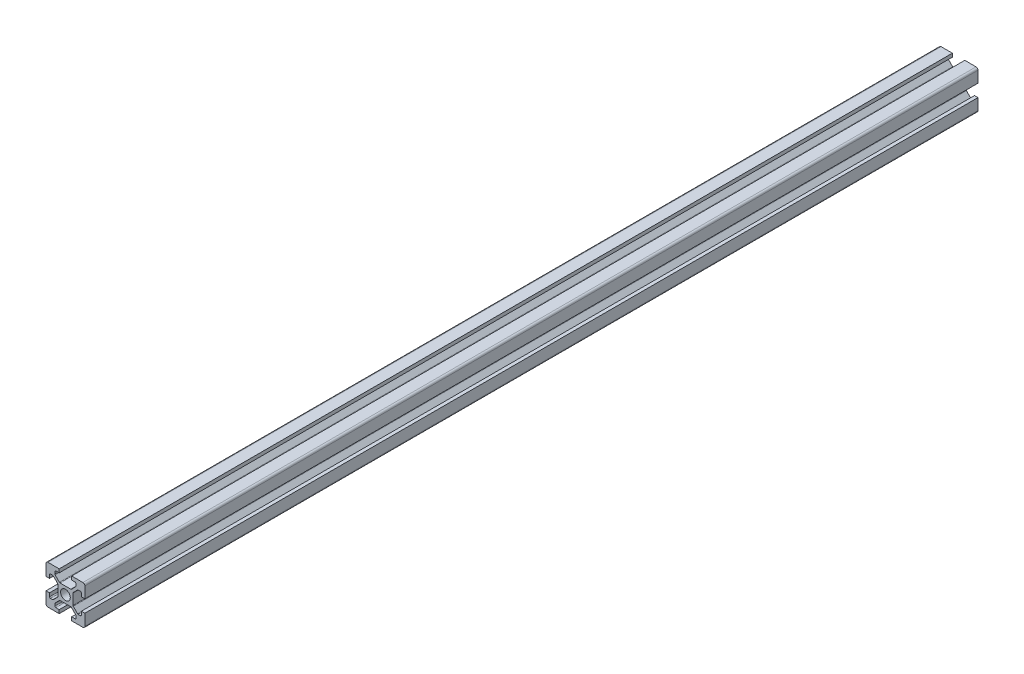
from build123d import *

# Parameters (mm, degrees)
SKETCH1_R           = 2.5
BOSS_EXTRUDE1_DEPTH = 230
FILLET1_R           = 1
FILLET2_R           = 0.5
FILLET3_R           = 0.5
FILLET4_R           = 0.5
FILLET5_R           = 0.5


with BuildPart() as part:
    # Sketch1 → Boss-Extrude1 (new, symmetric)
    with BuildSketch(Plane.XY):
        Polygon((13.2, 0), (13.2, 1.8), (15.45, 1.8), (15.45, 3.6), (12.95, 6.1), (7.05, 6.1), (4.55, 3.6), (4.55, 1.8), (6.8, 1.8), (6.8, 0), (0, 0), (0, 6.8), (1.8, 6.8), (1.8, 4.55), (3.6, 4.55), (6.1, 7.05), (6.1, 12.95), (3.6, 15.45), (1.8, 15.45), (1.8, 13.2), (0, 13.2), (0, 20), (6.8, 20), (6.8, 18.2), (4.55, 18.2), (4.55, 16.4), (7.05, 13.9), (12.95, 13.9), (15.45, 16.4), (15.45, 18.2), (13.2, 18.2), (13.2, 20), (20, 20), (20, 13.2), (18.2, 13.2), (18.2, 15.45), (16.4, 15.45), (13.9, 12.95), (13.9, 7.05), (16.4, 4.55), (18.2, 4.55), (18.2, 6.8), (20, 6.8), (20, 0), align=None)
        with Locations((10, 10)):
            Circle(SKETCH1_R, mode=Mode.SUBTRACT)
    extrude(amount=BOSS_EXTRUDE1_DEPTH, both=True)

    # Fillet1
    fillet1_edges = [part.edges().sort_by_distance(p)[0] for p in [
        (0, 0, 0),
        (0, 20, 0),
        (20, 20, 0),
        (20, 0, 0),
    ]]
    fillet(fillet1_edges, radius=FILLET1_R)

    # Fillet2
    fillet2_edges = [part.edges().sort_by_distance(p)[0] for p in [
        (4.55, 18.2, 0),
        (4.55, 16.4, 0),
        (7.05, 13.9, 0),
        (12.95, 13.9, 0),
        (15.45, 16.4, 0),
        (15.45, 18.2, 0),
    ]]
    fillet(fillet2_edges, radius=FILLET2_R)

    # Fillet3
    fillet3_edges = [part.edges().sort_by_distance(p)[0] for p in [
        (18.2, 15.45, 0),
        (16.4, 15.45, 0),
        (13.9, 12.95, 0),
        (13.9, 7.05, 0),
        (16.4, 4.55, 0),
        (18.2, 4.55, 0),
    ]]
    fillet(fillet3_edges, radius=FILLET3_R)

    # Fillet4
    fillet4_edges = [part.edges().sort_by_distance(p)[0] for p in [
        (1.8, 4.55, 0),
        (3.6, 4.55, 0),
        (6.1, 7.05, 0),
        (6.1, 12.95, 0),
        (3.6, 15.45, 0),
        (1.8, 15.45, 0),
    ]]
    fillet(fillet4_edges, radius=FILLET4_R)

    # Fillet5
    fillet5_edges = [part.edges().sort_by_distance(p)[0] for p in [
        (15.45, 1.8, 0),
        (15.45, 3.6, 0),
        (12.95, 6.1, 0),
        (7.05, 6.1, 0),
        (4.55, 3.6, 0),
        (4.55, 1.8, 0),
    ]]
    fillet(fillet5_edges, radius=FILLET5_R)


solid = part.part
